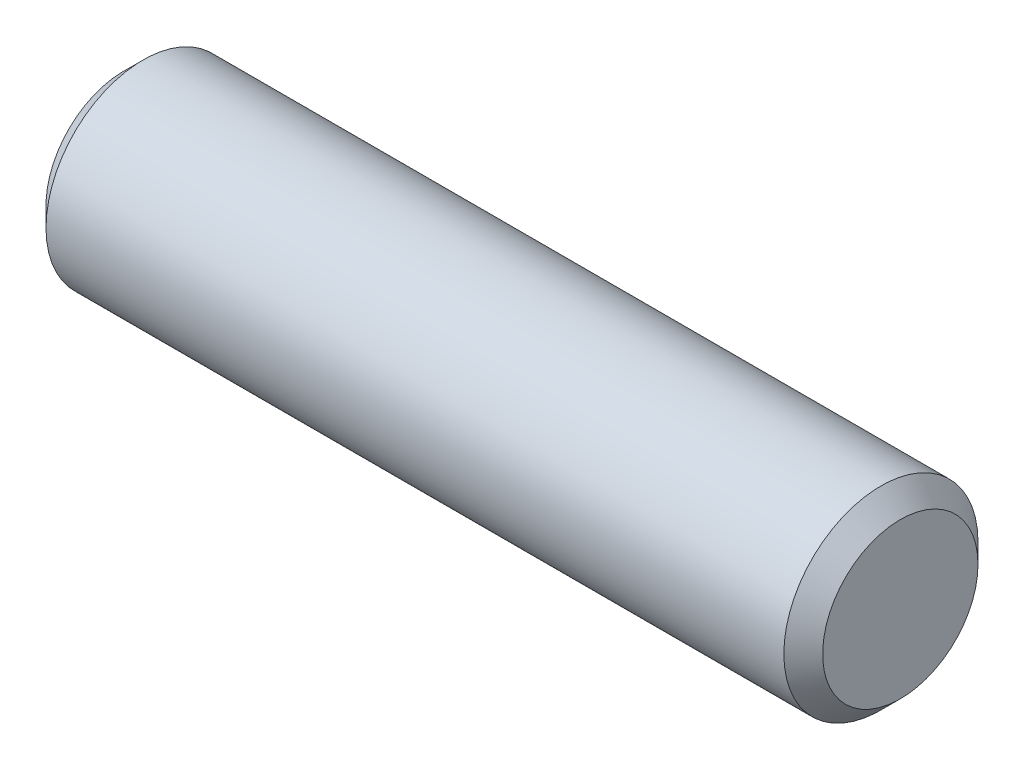
from build123d import *

# Parameters (mm, degrees)
EXTRUDE1_DEPTH      = 9.525
EXTRUDE1_DEPTH_BACK = 9.525
SKETCH2_R           = 2.38125
CHAMFER1_SIZE       = 0.47625


with BuildPart() as part:
    # Sketch2 → Extrude1 (new, two sides: drawn at the far end of the back side and taken through both)
    with BuildSketch(Plane(origin=(0, 0, 0), x_dir=(0, 0, -1), z_dir=(1, 0, 0)).offset(-EXTRUDE1_DEPTH_BACK)):
        Circle(SKETCH2_R)
    extrude(amount=EXTRUDE1_DEPTH + EXTRUDE1_DEPTH_BACK)

    # Chamfer1
    chamfer1_edges = [part.edges().sort_by_distance(p)[0] for p in [
        (-9.525, 0, 2.38125),
        (9.525, 0, 2.38125),
    ]]
    chamfer(chamfer1_edges, length=CHAMFER1_SIZE)


solid = part.part
